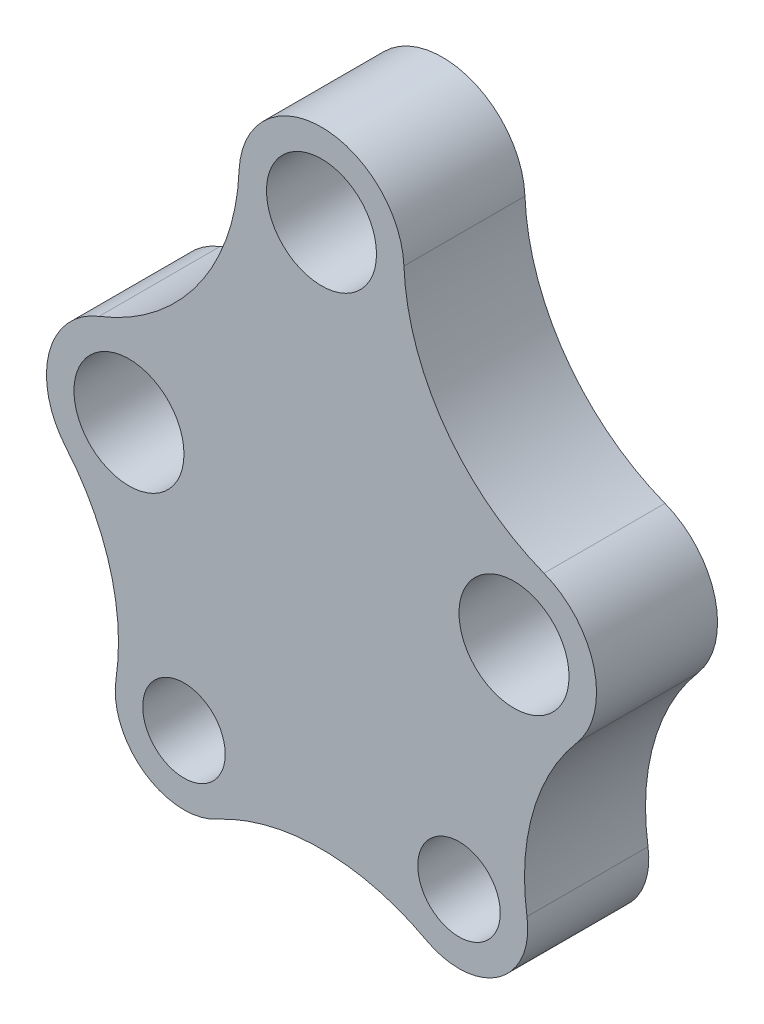
from build123d import *

# Parameters (mm, degrees)
SKETCH1_R           = 20
SKETCH1_R_2         = 15
BOSS_EXTRUDE1_DEPTH = 22


with BuildPart() as part:
    # Sketch1 → Boss-Extrude1 (new, symmetric)
    with BuildSketch(Plane.XY):
        with BuildLine():
            ThreePointArc((29.974824802, 99.228770963), (0, 128), (-29.974824802, 99.228770963))
            ThreePointArc((-29.974824802, 99.228770963), (-44.809013245, 56.006438032), (-80.883915711, 27.95604369))
            ThreePointArc((-80.883915711, 27.95604369), (-99.085824928, 7.349475372), (-92.857575187, -19.430163575))
            ThreePointArc((-92.857575187, -19.430163575), (-76.859583983, -49.370140698), (-74.716930719, -83.248555502))
            ThreePointArc((-74.716930719, -83.248555502), (-64.373950523, -107.45457275), (-38.095238095, -108.983553944))
            ThreePointArc((-38.095238095, -108.983553944), (0, -99.330926563), (38.095238095, -108.983553944))
            ThreePointArc((38.095238095, -108.983553944), (64.373950523, -107.45457275), (74.716930719, -83.248555502))
            ThreePointArc((74.716930719, -83.248555502), (76.859583983, -49.370140698), (92.857575187, -19.430163575))
            ThreePointArc((92.857575187, -19.430163575), (99.085824928, 7.349475372), (80.883915711, 27.95604369))
            ThreePointArc((80.883915711, 27.95604369), (44.809013245, 56.006438032), (29.974824802, 99.228770963))
        make_face()
        with Locations((0, 98)):
            Circle(SKETCH1_R, mode=Mode.SUBTRACT)
        with Locations((70, 0)):
            Circle(SKETCH1_R, mode=Mode.SUBTRACT)
        with Locations((-70, 0)):
            Circle(SKETCH1_R, mode=Mode.SUBTRACT)
        with Locations((50, -87)):
            Circle(SKETCH1_R_2, mode=Mode.SUBTRACT)
        with Locations((-50, -87)):
            Circle(SKETCH1_R_2, mode=Mode.SUBTRACT)
    extrude(amount=BOSS_EXTRUDE1_DEPTH, both=True)


solid = part.part
